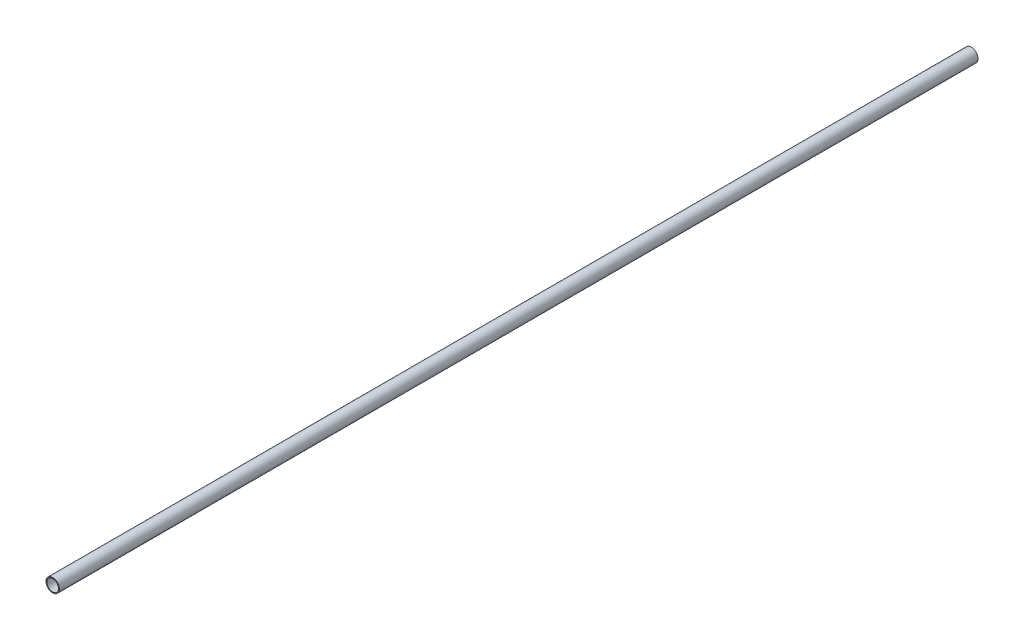
from build123d import *

# Parameters (mm, degrees)
SKETCH_1_R      = 8
SKETCH_1_R_2    = 7
EXTRUDE_1_DEPTH = 550


with BuildPart() as part:
    # Эскиз1 → Бобышка-Вытянуть1 (new, symmetric)
    with BuildSketch(Plane.XY):
        Circle(SKETCH_1_R)
        Circle(SKETCH_1_R_2, mode=Mode.SUBTRACT)
    extrude(amount=EXTRUDE_1_DEPTH, both=True)


solid = part.part
